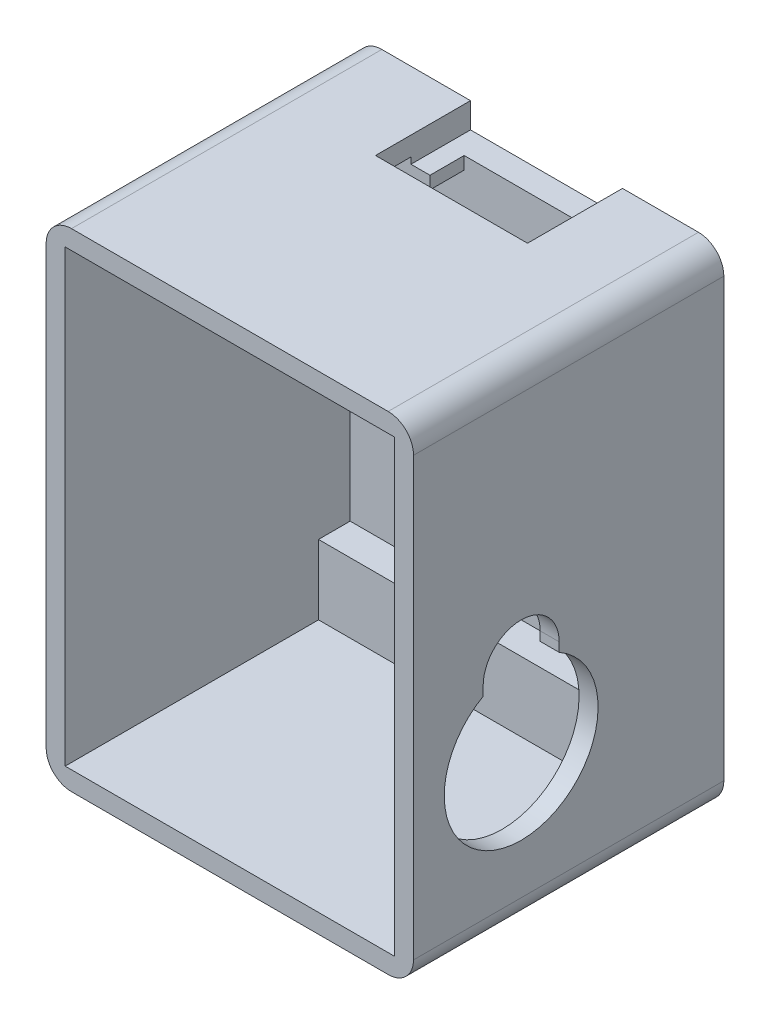
from build123d import *

# Parameters (mm, degrees)
SKETCH_1_W               = 29
SKETCH_1_H               = 38.5
EXTRUDE_1_DEPTH          = 24
SHELL_1_T                = -1.5
SKETCH_7_W               = 26
SKETCH_7_H               = 5.5
EXTRUDE_7_DEPTH          = 2.5
SKETCH_5_W               = 2.7
SKETCH_5_H               = 1.5
EXTRUDE_8_DEPTH          = 8
SKETCH_6_W               = 2.7
SKETCH_6_H               = 1.5
EXTRUDE_9_DEPTH          = 9
SKETCH_9_W               = 29
SKETCH_9_H               = 38.5
EXTRUDE_10_DEPTH         = 0.5
FILLET_3_R               = 2
CUT_EXTRUDE_8_DEPTH      = 1.5
CUT_EXTRUDE_8_DEPTH_BACK = 7
SKETCH_2_W               = 12
SKETCH_2_H               = 2
SKETCH_10_R              = 3
SKETCH_10_R_2            = 6.072147162
CUT_EXTRUDE_9_DEPTH      = 1.5


with BuildPart() as part:
    # 草图1 → 凸台-拉伸1 (new body)
    with BuildSketch(Plane.XY):
        with Locations((14.5, -19.25)):
            Rectangle(SKETCH_1_W, SKETCH_1_H)
    extrude(amount=EXTRUDE_1_DEPTH)

    # 抽壳1
    shell_1_openings = [part.faces().sort_by_distance(p)[0] for p in [
        (14.5, -19.25, 24),
    ]]
    offset(amount=SHELL_1_T, openings=shell_1_openings, kind=Kind.INTERSECTION)

    # 草图7 → 凸台-拉伸7 (add)
    with BuildSketch(Plane.XY.offset(1.5)):
        with Locations((14.5, -34.25)):
            Rectangle(SKETCH_7_W, SKETCH_7_H)
    extrude(amount=EXTRUDE_7_DEPTH)

    # 草图5 → 凸台-拉伸8 (add)
    with BuildSketch(Plane.ZY.offset(-27.5)):
        with Locations((2.85, -2.25)):
            Rectangle(SKETCH_5_W, SKETCH_5_H)
    extrude(amount=EXTRUDE_8_DEPTH)

    # 草图6 → 凸台-拉伸9 (add)
    with BuildSketch(Plane(origin=(1.5, 0, 0), x_dir=(0, 0, -1), z_dir=(1, 0, 0))):
        with Locations((-2.85, -2.25)):
            Rectangle(SKETCH_6_W, SKETCH_6_H)
    extrude(amount=EXTRUDE_9_DEPTH)

    # 草图9 → 凸台-拉伸10 (add)
    with BuildSketch(Plane(origin=(0, 0, 0), x_dir=(-1, 0, 0), z_dir=(0, 0, -1))):
        with Locations((-14.5, -19.25)):
            Rectangle(SKETCH_9_W, SKETCH_9_H)
    extrude(amount=EXTRUDE_10_DEPTH)

    # 圆角3
    fillet_3_edges = [part.edges().sort_by_distance(p)[0] for p in [
        (0, 0, 11.75),
        (29, 0, 11.75),
        (29, -38.5, 11.75),
        (0, -38.5, 11.75),
    ]]
    fillet(fillet_3_edges, radius=FILLET_3_R)

    # 草图2 → 切除-拉伸8 (cut, two sides: drawn at the far end of the back side and taken through both)
    with BuildSketch(Plane(origin=(0, 0, 0), x_dir=(-1, 0, 0), z_dir=(0, 0, -1)).offset(-CUT_EXTRUDE_8_DEPTH_BACK)):
        with Locations((-15, -1)):
            Rectangle(SKETCH_2_W, SKETCH_2_H)
    extrude(amount=CUT_EXTRUDE_8_DEPTH + CUT_EXTRUDE_8_DEPTH_BACK, mode=Mode.SUBTRACT)

    # 草图10 → 切除-拉伸9 (cut)
    with BuildSketch(Plane(origin=(29, 0, 0), x_dir=(0, 0, -1), z_dir=(1, 0, 0))):
        with Locations((-15.5, -20.5)):
            Circle(SKETCH_10_R)
        with Locations((-15.5, -26.5)):
            Circle(SKETCH_10_R_2)
        with BuildLine():
            ThreePointArc((-18.422516621, -21.177419071), (-18.48056621, -20.840917978), (-18.5, -20.5))
            Line((-18.5, -20.5), (-18.5, -21.220703536))
            ThreePointArc((-18.5, -21.220703536), (-18.461337395, -21.198919734), (-18.422516621, -21.177419071))
        make_face()
        with BuildLine():
            Line((-12.5, -21.220703536), (-12.5, -20.5))
            ThreePointArc((-12.5, -20.5), (-12.51943379, -20.840917978), (-12.577483379, -21.177419071))
            ThreePointArc((-12.577483379, -21.177419071), (-12.538662605, -21.198919734), (-12.5, -21.220703536))
        make_face()
    extrude(amount=-CUT_EXTRUDE_9_DEPTH, mode=Mode.SUBTRACT)


solid = part.part
